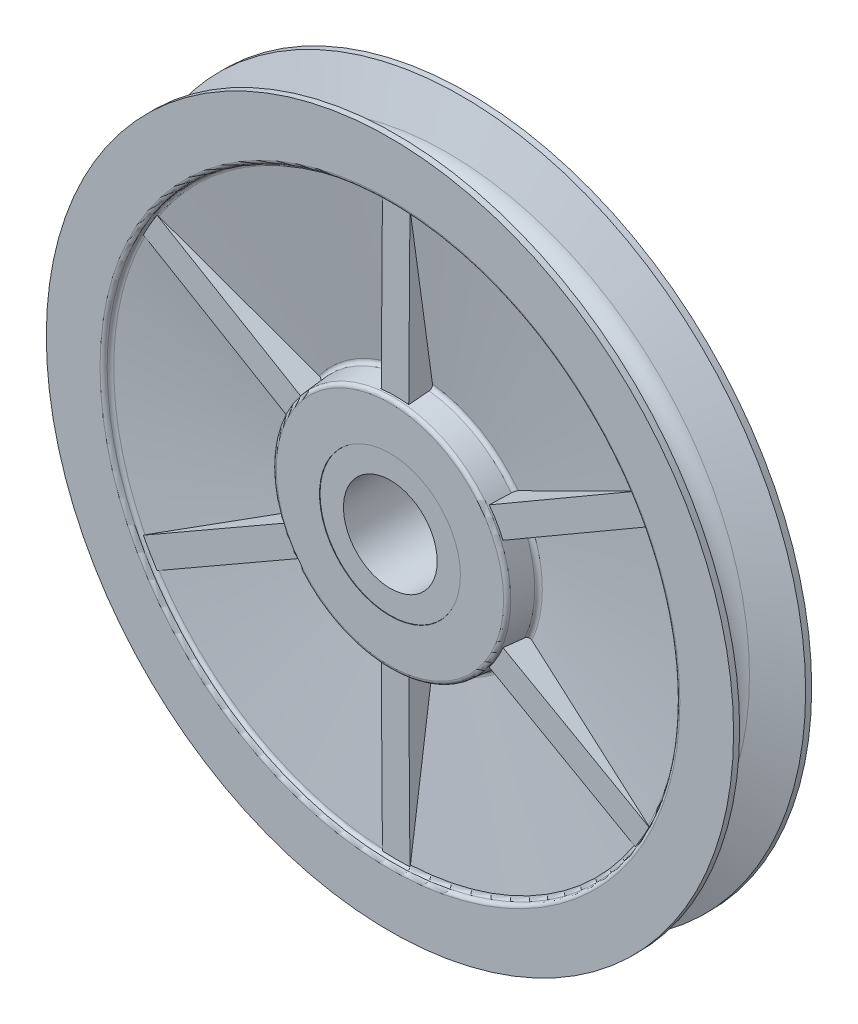
from build123d import *

# Parameters (mm, degrees)
CUT_EXTRUDE_THIN1_DEPTH      = 100.101205372
CUT_EXTRUDE_THIN1_DEPTH_BACK = 100.101205372
SKETCH2_R                    = 14.3129
SKETCH2_R_2                  = 14.2875
DRAFT1_ANGLE                 = 5
DRAFT2_ANGLE                 = 15
FILLET1_R                    = 0.762
FILLET2_R                    = 0.762
BOSS_EXTRUDE1_DEPTH          = 2.794
CIRPATTERN1_COUNT            = 6
CIRPATTERN1_COPY_1_DEPTH     = 2.794
CIRPATTERN1_COPY_2_DEPTH     = 2.794
CIRPATTERN1_COPY_3_DEPTH     = 2.794
CIRPATTERN1_COPY_4_DEPTH     = 2.794
CIRPATTERN1_COPY_5_DEPTH     = 2.794


with BuildPart() as part:
    # Sketch1 → Revolve1 (revolve)
    with BuildSketch(Plane(origin=(0, 0, 0), x_dir=(0, 0, -1), z_dir=(1, 0, 0)), mode=Mode.PRIVATE) as revolve1_sk:
        with BuildLine():
            Line((6.7056, 69.85), (7.9375, 69.85))
            Line((7.9375, 69.85), (7.9375, 58.2295))
            Line((7.9375, 58.2295), (6.6675, 58.2295))
            Line((6.6675, 58.2295), (1.905, 23.8125))
            Line((1.905, 23.8125), (7.9375, 23.8125))
            Line((7.9375, 23.8125), (7.9375, 14.2875))
            Line((7.9375, 14.2875), (7.8613, 14.2875))
            Line((7.8613, 14.2875), (7.8613, 9.525))
            Line((7.8613, 9.525), (-7.8613, 9.525))
            Line((-7.8613, 9.525), (-7.8613, 14.2875))
            Line((-7.8613, 14.2875), (-7.9375, 14.2875))
            Line((-7.9375, 14.2875), (-7.9375, 23.8125))
            Line((-7.9375, 23.8125), (-1.905, 23.8125))
            Line((-1.905, 23.8125), (-6.6675, 58.2295))
            Line((-6.6675, 58.2295), (-7.9375, 58.2295))
            Line((-7.9375, 58.2295), (-7.9375, 69.85))
            Line((-7.9375, 69.85), (-6.7056, 69.85))
            Line((-6.7056, 69.85), (-3.745872608, 61.394985356))
            ThreePointArc((-3.745872608, 61.394985356), (0, 58.7375), (3.745872608, 61.394985356))
            Line((3.745872608, 61.394985356), (6.7056, 69.85))
        make_face()
    revolve(revolve1_sk.sketch.rotate(Axis((0, 0, 7.9375), (0, 0, -1)), 90), axis=Axis((0, 0, 7.9375), (0, 0, -1)))

    # Sketch2 → Cut-Extrude-Thin1 (cut, two sides: drawn at the far end of the back side and taken through both)
    with BuildSketch(Plane.XY.offset(-CUT_EXTRUDE_THIN1_DEPTH_BACK)):
        Circle(SKETCH2_R)
        Circle(SKETCH2_R_2, mode=Mode.SUBTRACT)
    extrude(amount=CUT_EXTRUDE_THIN1_DEPTH + CUT_EXTRUDE_THIN1_DEPTH_BACK, mode=Mode.SUBTRACT)


with BuildPart() as cut_extrude_thin1_piece_1:
    # of the separate pieces the step leaves, piece 1, a body of its own (cut_extrude_thin1_pieces)
    add(part.part.solids().sort_by_distance((61.394985356, 0, 3.745872608))[0])

    # Draft1
    draft1_faces = [cut_extrude_thin1_piece_1.faces().sort_by_distance(p)[0] for p in [
        (-23.8125, 0, 4.92125),
        (-58.2295, 0, 7.3025),
    ]]
    draft(draft1_faces, Plane(origin=(0, 58.2295, 7.9375), x_dir=(1, 0, 0), z_dir=(0, 0, 1)), DRAFT1_ANGLE)

    # Draft2
    draft2_faces = [cut_extrude_thin1_piece_1.faces().sort_by_distance(p)[0] for p in [
        (-23.8125, 0, -4.92125),
        (-58.2295, 0, -7.3025),
    ]]
    draft(draft2_faces, Plane(origin=(0, 69.85, -7.9375), x_dir=(-1, 0, 0), z_dir=(0, 0, -1)), DRAFT2_ANGLE)

    # Fillet1
    fillet1_edges = [cut_extrude_thin1_piece_1.edges().sort_by_distance(p)[0] for p in [
        (-58.2295, 0, 7.9375),
        (-23.8125, 0, 7.9375),
        (-23.8125, 0, -7.9375),
        (-58.2295, 0, -7.9375),
    ]]
    fillet(fillet1_edges, radius=FILLET1_R)

    # Fillet2
    fillet2_edges = [cut_extrude_thin1_piece_1.edges().sort_by_distance(p)[0] for p in [
        (-24.333962349, 0, 1.977158074),
        (-58.117027767, 0, 6.651936499),
    ]]
    fillet(fillet2_edges, radius=FILLET2_R)



with BuildPart() as cut_extrude_thin1_piece_2:
    # of the separate pieces the step leaves, piece 2, a body of its own (cut_extrude_thin1_pieces)
    add(part.part.solids().sort_by_distance((9.525, 0, 7.8613))[0])


with BuildPart() as cut_extrude_thin1_piece_1_1:
    add(cut_extrude_thin1_piece_1.part)

    add(cut_extrude_thin1_piece_2.part)  # Boss-Extrude1 merges Cut-Extrude-Thin1 piece 2
    # Sketch5 → Boss-Extrude1 (add, symmetric)
    with BuildSketch(Plane(origin=(0, 0, 0), x_dir=(0, 0, -1), z_dir=(1, 0, 0))):
        Polygon((-6.9215, 22.5425), (-6.6675, 58.2295), (0, 58.2295), (0, 14.2875), (-6.9215, 14.2875), align=None)
    boss_extrude1 = extrude(amount=BOSS_EXTRUDE1_DEPTH, both=True)

    # Mirror1: Boss-Extrude1 across plane
    add(boss_extrude1.mirror(Plane.XY))

    # CirPattern1: Boss-Extrude1 ×6 about axis
    cirpattern1_axis = Axis((0, 0, 0), (0, 0, 1))
    for i in range(1, CIRPATTERN1_COUNT):
        add(boss_extrude1.rotate(cirpattern1_axis, i * 360 / CIRPATTERN1_COUNT))

    # CirPattern1 copy 1 sketch → CirPattern1 copy 1 (add, symmetric)
    with BuildSketch(Plane(origin=(0, 0, 0), x_dir=(0, 0, 1), z_dir=(0.5000000000000001, 0.8660254037844386, 0))):
        Polygon((-6.9215, -22.5425), (-6.6675, -58.2295), (0, -58.2295), (0, -14.2875), (-6.9215, -14.2875), align=None)
    extrude(amount=CIRPATTERN1_COPY_1_DEPTH, both=True)

    # CirPattern1 copy 2 sketch → CirPattern1 copy 2 (add, symmetric)
    with BuildSketch(Plane(origin=(0, 0, 0), x_dir=(0, 0, 1), z_dir=(-0.4999999999999998, 0.8660254037844387, 0))):
        Polygon((-6.9215, -22.5425), (-6.6675, -58.2295), (0, -58.2295), (0, -14.2875), (-6.9215, -14.2875), align=None)
    extrude(amount=CIRPATTERN1_COPY_2_DEPTH, both=True)

    # CirPattern1 copy 3 sketch → CirPattern1 copy 3 (add, symmetric)
    with BuildSketch(Plane.ZY):
        Polygon((-6.9215, -22.5425), (-6.6675, -58.2295), (0, -58.2295), (0, -14.2875), (-6.9215, -14.2875), align=None)
    extrude(amount=CIRPATTERN1_COPY_3_DEPTH, both=True)

    # CirPattern1 copy 4 sketch → CirPattern1 copy 4 (add, symmetric)
    with BuildSketch(Plane(origin=(0, 0, 0), x_dir=(0, 0, 1), z_dir=(-0.5000000000000004, -0.8660254037844384, 0))):
        Polygon((-6.9215, -22.5425), (-6.6675, -58.2295), (0, -58.2295), (0, -14.2875), (-6.9215, -14.2875), align=None)
    extrude(amount=CIRPATTERN1_COPY_4_DEPTH, both=True)

    # CirPattern1 copy 5 sketch → CirPattern1 copy 5 (add, symmetric)
    with BuildSketch(Plane(origin=(0, 0, 0), x_dir=(0, 0, 1), z_dir=(0.5000000000000001, -0.8660254037844386, 0))):
        Polygon((-6.9215, -22.5425), (-6.6675, -58.2295), (0, -58.2295), (0, -14.2875), (-6.9215, -14.2875), align=None)
    extrude(amount=CIRPATTERN1_COPY_5_DEPTH, both=True)


solid = cut_extrude_thin1_piece_1_1.part
